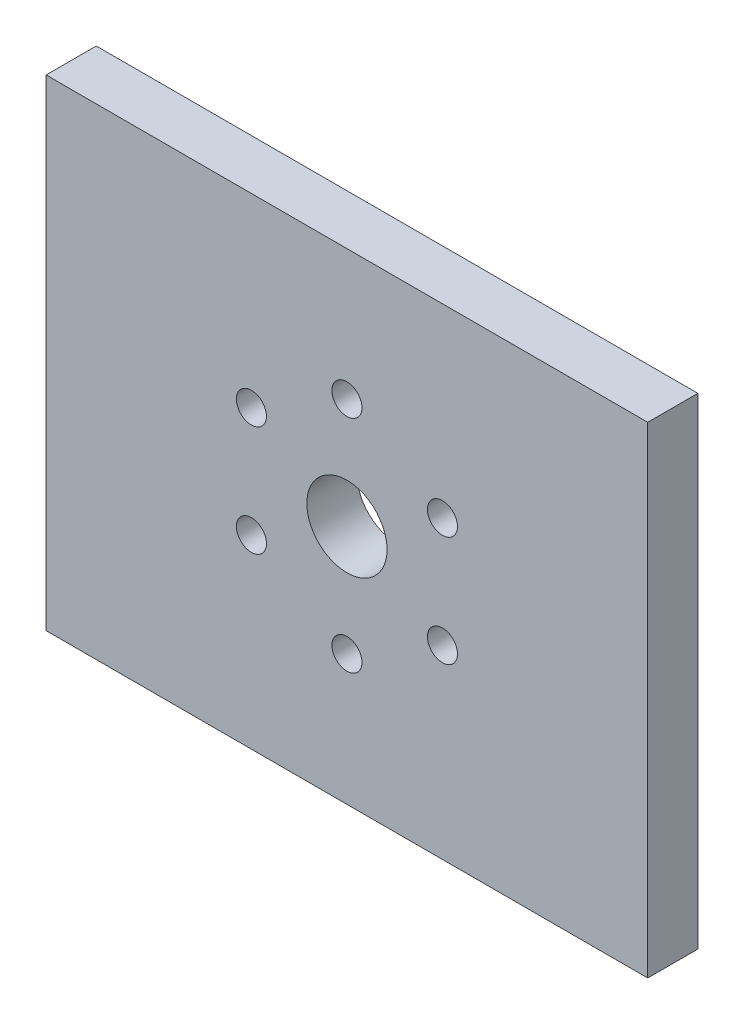
from build123d import *

# Parameters (mm, degrees)
SKETCH1_W           = 60
SKETCH1_H           = 48
SKETCH1_R           = 1.5
SKETCH1_R_2         = 4
BOSS_EXTRUDE1_DEPTH = 5


with BuildPart() as part:
    # Sketch1 → Boss-Extrude1 (new body)
    with BuildSketch(Plane.XY):
        with Locations((0, 24)):
            Rectangle(SKETCH1_W, SKETCH1_H)
        with Locations((0, 35)):
            Circle(SKETCH1_R, mode=Mode.SUBTRACT)
        with Locations((9.526279442, 29.5)):
            Circle(SKETCH1_R, mode=Mode.SUBTRACT)
        with Locations((9.526279442, 18.5)):
            Circle(SKETCH1_R, mode=Mode.SUBTRACT)
        with Locations((0, 13)):
            Circle(SKETCH1_R, mode=Mode.SUBTRACT)
        with Locations((-9.526279442, 18.5)):
            Circle(SKETCH1_R, mode=Mode.SUBTRACT)
        with Locations((-9.526279442, 29.5)):
            Circle(SKETCH1_R, mode=Mode.SUBTRACT)
        with Locations((0, 24)):
            Circle(SKETCH1_R_2, mode=Mode.SUBTRACT)
    extrude(amount=BOSS_EXTRUDE1_DEPTH)


solid = part.part
